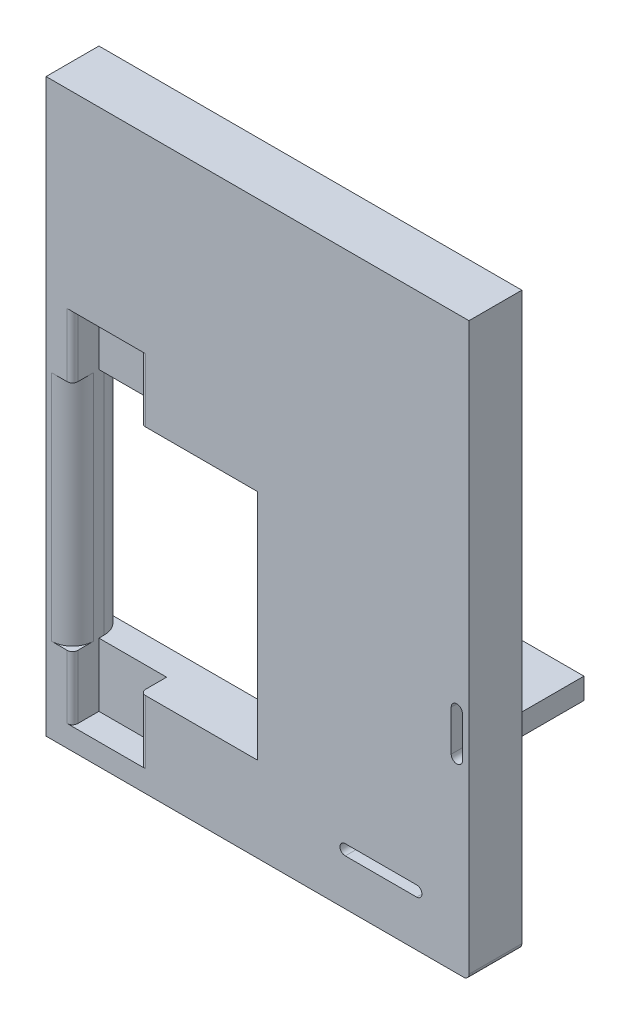
from build123d import *

# Parameters (mm, degrees)
SKETCH1_W           = 200
SKETCH1_H           = 240
BOSS_EXTRUDE3_DEPTH = 25
SKETCH3_W           = 87.5
SKETCH3_H           = 110
CUT_EXTRUDE1_DEPTH  = 25
SKETCH4_W           = 200
SKETCH4_H           = 30.164162566
BOSS_EXTRUDE4_DEPTH = 25
FILLET4_R           = 10
FILLET5_R           = 10
SKETCH6_W           = 32
SKETCH6_H           = 30
CUT_EXTRUDE2_DEPTH  = 12.5
FILLET6_R           = 2.5
FILLET7_R           = 2.5
FILLET8_R           = 2.5
SKETCH8_W           = 72.718372575
SKETCH8_H           = 10
BOSS_EXTRUDE5_DEPTH = 40
FILLET9_R           = 2.5
CUT_EXTRUDE3_DEPTH  = 40
CUT_EXTRUDE4_DEPTH  = 40


with BuildPart() as part:
    # Sketch1 → Boss-Extrude3 (new body)
    with BuildSketch(Plane.XY):
        Rectangle(SKETCH1_W, SKETCH1_H)
    extrude(amount=BOSS_EXTRUDE3_DEPTH)

    # Sketch3 → Cut-Extrude1 (cut)
    with BuildSketch(Plane.XY.offset(25)):
        with Locations((-43.75, -55)):
            Rectangle(SKETCH3_W, SKETCH3_H)
    extrude(amount=-CUT_EXTRUDE1_DEPTH, mode=Mode.SUBTRACT)

    # Sketch4 → Boss-Extrude4 (add)
    with BuildSketch(Plane.XY.offset(25)):
        with Locations((0, -135.082081283)):
            Rectangle(SKETCH4_W, SKETCH4_H)
    extrude(amount=-BOSS_EXTRUDE4_DEPTH)

    # Fillet4
    fillet4_edges = [part.edges().sort_by_distance(p)[0] for p in [
        (-87.5, -55, 25),
    ]]
    fillet(fillet4_edges, radius=FILLET4_R)

    # Fillet5
    fillet5_edges = [part.edges().sort_by_distance(p)[0] for p in [
        (-87.5, -55, 0),
    ]]
    fillet(fillet5_edges, radius=FILLET5_R)

    # Sketch6 → Cut-Extrude2 (cut)
    with BuildSketch(Plane.XY.offset(25)):
        with Locations((-71.5, -125)):
            Rectangle(SKETCH6_W, SKETCH6_H)
    cut_extrude2 = extrude(amount=-CUT_EXTRUDE2_DEPTH, mode=Mode.SUBTRACT)

    # Fillet6
    fillet6_edges = [part.edges().sort_by_distance(p)[0] for p in [
        (-87.5, -125, 25),
    ]]
    fillet(fillet6_edges, radius=FILLET6_R)

    # Fillet7
    fillet7_edges = [part.edges().sort_by_distance(p)[0] for p in [
        (-55.5, -125, 25),
    ]]
    fillet(fillet7_edges, radius=FILLET7_R)

    # Fillet8
    fillet8_edges = [part.edges().sort_by_distance(p)[0] for p in [
        (100, -150.164162566, 12.5),
    ]]
    fillet(fillet8_edges, radius=FILLET8_R)

    # Mirror1: Cut-Extrude2 across plane
    add(cut_extrude2.mirror(Plane.ZX.offset(-55)), mode=Mode.SUBTRACT)

    # Sketch8 → Boss-Extrude5 (add)
    with BuildSketch(Plane(origin=(0, 0, 0), x_dir=(-1, 0, 0), z_dir=(0, 0, -1))):
        with Locations((-53.00826824, -68.393983819)):
            Rectangle(SKETCH8_W, SKETCH8_H)
    extrude(amount=BOSS_EXTRUDE5_DEPTH)

    # Fillet9
    fillet9_edges = [part.edges().sort_by_distance(p)[0] for p in [
        (-87.5, 15, 25),
        (-55.5, 15, 25),
    ]]
    fillet(fillet9_edges, radius=FILLET9_R)

    # Sketch9 → Cut-Extrude3 (cut)
    with BuildSketch(Plane(origin=(0, 0, 0), x_dir=(-1, 0, 0), z_dir=(0, 0, -1))):
        with BuildLine():
            Line((-91.597538887, -42.469319431), (-91.597538887, -61.749189722))
            ThreePointArc((-91.597538887, -61.749189722), (-94.256831341, -64.408482175), (-96.916123795, -61.749189722))
            Line((-96.916123795, -61.749189722), (-96.916123795, -42.469319431))
            ThreePointArc((-96.916123795, -42.469319431), (-94.256831341, -39.810026977), (-91.597538887, -42.469319431))
        make_face()
    extrude(amount=-CUT_EXTRUDE3_DEPTH, mode=Mode.SUBTRACT)

    # Sketch10 → Cut-Extrude4 (cut)
    with BuildSketch(Plane(origin=(0, 0, 0), x_dir=(-1, 0, 0), z_dir=(0, 0, -1))):
        with BuildLine():
            Line((-75.267088852, -123.445469049), (-41.491938711, -123.445469049))
            ThreePointArc((-41.491938711, -123.445469049), (-38.991938711, -125.945469049), (-41.491938711, -128.445469049))
            Line((-41.491938711, -128.445469049), (-75.267088852, -128.445469049))
            ThreePointArc((-75.267088852, -128.445469049), (-77.767088852, -125.945469049), (-75.267088852, -123.445469049))
        make_face()
    extrude(amount=-CUT_EXTRUDE4_DEPTH, mode=Mode.SUBTRACT)


solid = part.part
